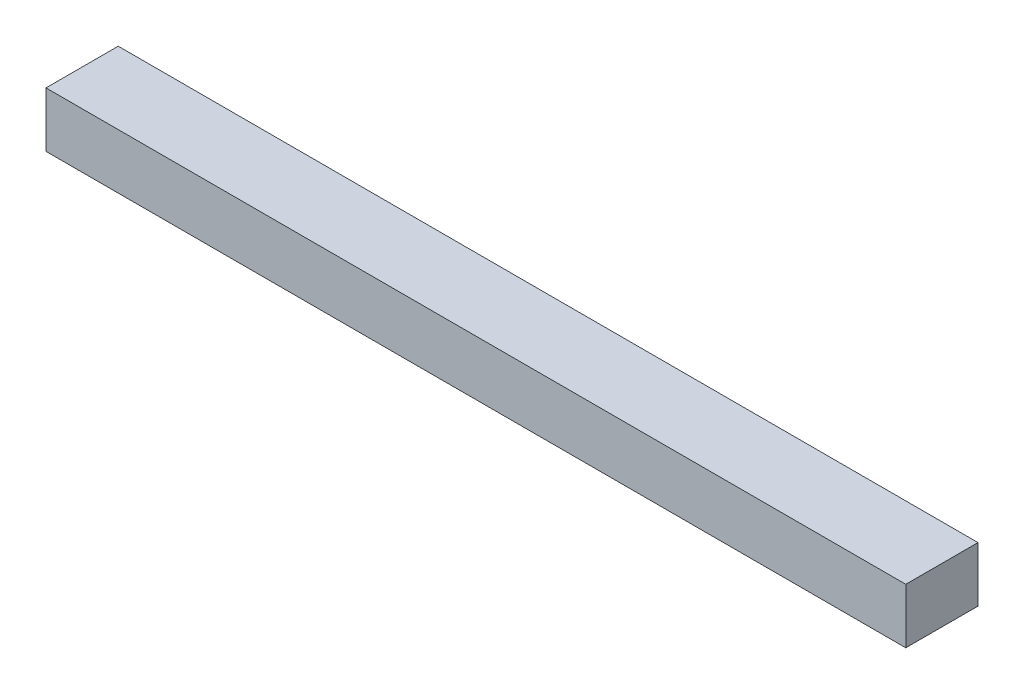
from build123d import *

# Parameters (mm, degrees)
SKETCH_1_W        = 2500
SKETCH_1_H        = 160
EXTRUDE_264_DEPTH = 210


with BuildPart() as part:
    # 草图1 → Extrude 264 (new body)
    with BuildSketch(Plane.XY):
        with Locations((1164.948484848, 59.718484848)):
            Rectangle(SKETCH_1_W, SKETCH_1_H)
    extrude(amount=EXTRUDE_264_DEPTH)


solid = part.part
